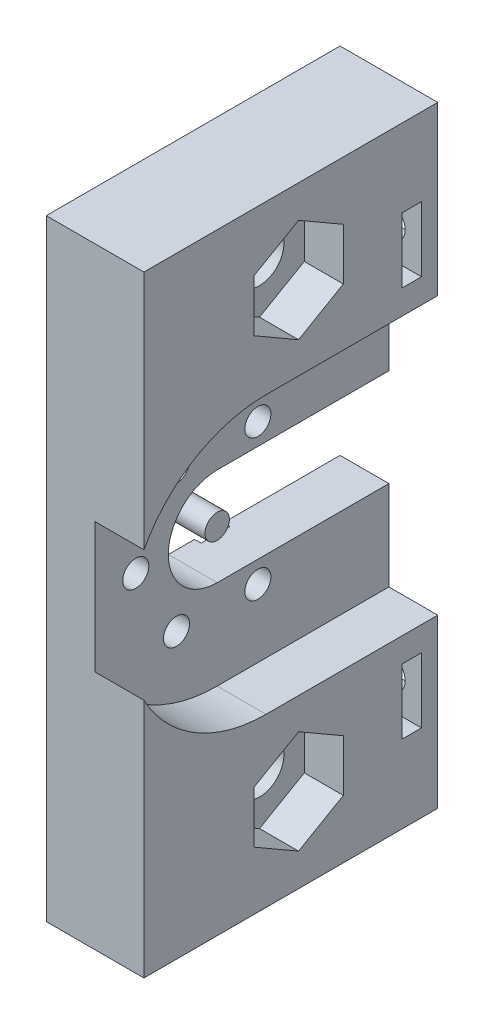
from build123d import *

# Parameters (mm, degrees)
SKETCH_2_W           = 40
SKETCH_2_H           = 15
EXTRUDE_5_DEPTH      = 3
SKETCH_10_R          = 0.8
CUT_EXTRUDE_2_DEPTH  = 23.186707732
CUT_EXTRUDE_3_DEPTH  = 23.186707732
SKETCH_12_R          = 8.5
CUT_EXTRUDE_4_DEPTH  = 3
SKETCH_13_R          = 1.6
CUT_EXTRUDE_5_DEPTH  = 0.4
SKETCH_15_R          = 0.75
EXTRUDE_6_DEPTH      = 3
SKETCH_16_R          = 1.5
CUT_EXTRUDE_6_DEPTH  = 23.186707732
SKETCH_18_R          = 2.05
CUT_EXTRUDE_8_DEPTH  = 1
CUT_EXTRUDE_10_DEPTH = 2.4
EXTRUDE_7_DEPTH      = 3.05
SKETCH_24_W          = 3
SKETCH_24_H          = 3.05
EXTRUDE_8_DEPTH      = 1.08
SKETCH_25_W          = 3
SKETCH_25_H          = 3.05
EXTRUDE_9_DEPTH      = 1
SKETCH_26_R          = 8.5
SKETCH_26_W          = 17
SKETCH_26_H          = 10.55
CUT_EXTRUDE_11_DEPTH = 3
SKETCH_28_W          = 1.220805659
SKETCH_28_H          = 18.05
CUT_EXTRUDE_12_DEPTH = 24.394497216
SKETCH_29_W          = 4
SKETCH_29_H          = 1.2
CUT_EXTRUDE_13_DEPTH = 4
SKETCH_30_R          = 1
CUT_EXTRUDE_14_DEPTH = 26.541351571


with BuildPart() as part:
    # ｽｹｯﾁ2 → ﾎﾞｽ - 押し出し5 (new, symmetric)
    with BuildSketch(Plane.YZ):
        Rectangle(SKETCH_2_W, SKETCH_2_H)
    extrude(amount=EXTRUDE_5_DEPTH, both=True)

    # ｽｹｯﾁ10 → ｶｯﾄ - 押し出し2 (cut, through all)
    with BuildSketch(Plane.YZ.offset(3)):
        with Locations(Location((-4.330127019, 2.5, 0), (0, 0, 270))):
            Circle(SKETCH_10_R)
        with Locations(Location((4.330127019, -2.5, 0), (0, 0, 270))):
            Circle(SKETCH_10_R)
        with Locations(Location((0, 5, 0), (0, 0, 270))):
            Circle(SKETCH_10_R)
        with Locations(Location((4.330127019, 2.5, 0), (0, 0, 270))):
            Circle(SKETCH_10_R)
        with Locations(Location((-4.330127019, -2.5, 0), (0, 0, 270))):
            Circle(SKETCH_10_R)
    extrude(amount=-CUT_EXTRUDE_2_DEPTH, mode=Mode.SUBTRACT)

    # ｽｹｯﾁ11 → ｶｯﾄ - 押し出し3 (cut, through all)
    with BuildSketch(Plane.YZ.offset(3)):
        with BuildLine():
            ThreePointArc((3, 0), (0, -3), (-3, 0))
            Line((-3, 0), (-3, -7.5))
            Line((-3, -7.5), (3, -7.5))
            Line((3, -7.5), (3, 0))
        make_face()
        with BuildLine():
            ThreePointArc((3, 0), (0, 3), (-3, 0))
            Line((-3, 0), (3, 0))
        make_face()
        with BuildLine():
            Line((3, 0), (-3, 0))
            ThreePointArc((-3, 0), (0, -3), (3, 0))
        make_face()
    extrude(amount=-CUT_EXTRUDE_3_DEPTH, mode=Mode.SUBTRACT)

    # ｽｹｯﾁ12 → ｶｯﾄ - 押し出し4 (cut)
    with BuildSketch(Plane.YZ.offset(3)):
        Circle(SKETCH_12_R)
    extrude(amount=-CUT_EXTRUDE_4_DEPTH, mode=Mode.SUBTRACT)

    # ｽｹｯﾁ13 → ｶｯﾄ - 押し出し5 (cut)
    with BuildSketch(Plane(origin=(-3, 0, 0), x_dir=(0, -1, 0), z_dir=(-1, 0, 0))):
        with Locations((-4.330127019, -2.5)):
            Circle(SKETCH_13_R)
        with Locations(Location((-4.330127019, 2.5, 0), (0, 0, 90))):
            Circle(SKETCH_13_R)
        with Locations(Location((0, 5, 0), (0, 0, 90))):
            Circle(SKETCH_13_R)
        with Locations(Location((4.330127019, 2.5, 0), (0, 0, 90))):
            Circle(SKETCH_13_R)
        with Locations((4.330127019, -2.5)):
            Circle(SKETCH_13_R)
    extrude(amount=-CUT_EXTRUDE_5_DEPTH, mode=Mode.SUBTRACT)

    # ｽｹｯﾁ16 → ｶｯﾄ - 押し出し6 (cut, through all)
    with BuildSketch(Plane(origin=(-3, 0, 0), x_dir=(0, -1, 0), z_dir=(-1, 0, 0))):
        with Locations(Location((-13.60376786, -2, 0), (0, 0, 90))):
            Circle(SKETCH_16_R)
        with Locations(Location((13.60376786, -2, 0), (0, 0, 90))):
            Circle(SKETCH_16_R)
    extrude(amount=-CUT_EXTRUDE_6_DEPTH, mode=Mode.SUBTRACT)

    # ｽｹｯﾁ18 → ｶｯﾄ - 押し出し8 (cut)
    with BuildSketch(Plane(origin=(-3, 0, 0), x_dir=(0, -1, 0), z_dir=(-1, 0, 0))):
        with Locations(Location((-13.60376786, -2, 0), (0, 0, 90))):
            Circle(SKETCH_18_R)
        with Locations(Location((13.60376786, -2, 0), (0, 0, 90))):
            Circle(SKETCH_18_R)
    extrude(amount=-CUT_EXTRUDE_8_DEPTH, mode=Mode.SUBTRACT)

    # ｽｹｯﾁ19 → ｶｯﾄ - 押し出し10 (cut)
    with BuildSketch(Plane.YZ.offset(3)):
        Polygon((15.191481101, -4.75), (16.779194341, -2), (15.191481101, 0.75), (12.01605462, 0.75), (10.42834138, -2), (12.01605462, -4.75), align=None)
        Polygon((-10.42834138, -2), (-12.01605462, 0.75), (-15.191481101, 0.75), (-16.779194341, -2), (-15.191481101, -4.75), (-12.01605462, -4.75), align=None)
    extrude(amount=-CUT_EXTRUDE_10_DEPTH, mode=Mode.SUBTRACT)

    # ｽｹｯﾁ23 → ﾎﾞｽ - 押し出し7 (add)
    with BuildSketch(Plane(origin=(0, 0, -7.5), x_dir=(1, 0, 0), z_dir=(0, 0, -1))):
        Polygon((-3, 4.077623582), (-3, 3), (0, 3), (0, 4.077623582), (3, 4.077623582), (3, 20), (-3, 20), align=None)
        Polygon((-3, -3), (0, -3), (0, -4), (3, -4), (3, -20), (-3, -20), (-3, -4), align=None)
    extrude(amount=EXTRUDE_7_DEPTH)

    # ｽｹｯﾁ24 → ﾎﾞｽ - 押し出し8 (add)
    with BuildSketch(Plane(origin=(0, -4.077623582, 0), x_dir=(-1, 0, 0), z_dir=(0, 1, 0))):
        with Locations((-1.5, -9.025)):
            Rectangle(SKETCH_24_W, SKETCH_24_H)
    extrude(amount=EXTRUDE_8_DEPTH)

    # ｽｹｯﾁ25 → ﾎﾞｽ - 押し出し9 (add)
    with BuildSketch(Plane.XZ.offset(-4)):
        with Locations((1.5, -9.025)):
            Rectangle(SKETCH_25_W, SKETCH_25_H)
    extrude(amount=EXTRUDE_9_DEPTH)

    # ｽｹｯﾁ26 → ｶｯﾄ - 押し出し11 (cut)
    with BuildSketch(Plane.YZ.offset(3)):
        Circle(SKETCH_26_R)
        with Locations((0, -5.275)):
            Rectangle(SKETCH_26_W, SKETCH_26_H)
    extrude(amount=-CUT_EXTRUDE_11_DEPTH, mode=Mode.SUBTRACT)

    # ｽｹｯﾁ28 → ｶｯﾄ - 押し出し12 (cut, through all)
    with BuildSketch(Plane.YZ.offset(3)):
        with Locations((-19.389597171, -1.525)):
            Rectangle(SKETCH_28_W, SKETCH_28_H)
        with Locations((19.389597171, -1.525)):
            Rectangle(SKETCH_28_W, SKETCH_28_H)
    extrude(amount=-CUT_EXTRUDE_12_DEPTH, mode=Mode.SUBTRACT)

    # ｽｹｯﾁ29 → ｶｯﾄ - 押し出し13 (cut)
    with BuildSketch(Plane.YZ.offset(3)):
        with Locations((-12, -8.95)):
            Rectangle(SKETCH_29_W, SKETCH_29_H)
        with Locations((12, -8.95)):
            Rectangle(SKETCH_29_W, SKETCH_29_H)
    extrude(amount=-CUT_EXTRUDE_13_DEPTH, mode=Mode.SUBTRACT)

    # ｽｹｯﾁ30 → ｶｯﾄ - 押し出し14 (cut, through all)
    with BuildSketch(Plane.XY.offset(-9.55)):
        with Locations((1, -12)):
            Circle(SKETCH_30_R)
        with Locations(Location((1, 12, 0), (0, 0, 180))):
            Circle(SKETCH_30_R)
    extrude(amount=-CUT_EXTRUDE_14_DEPTH, mode=Mode.SUBTRACT)


with BuildPart() as body_2:
    # ｽｹｯﾁ15 → ﾎﾞｽ - 押し出し6 (new body)
    with BuildSketch(Plane.YZ):
        with Locations(Location((0, 0, 0), (0, 0, 270))):
            Circle(SKETCH_15_R)
    extrude(amount=-EXTRUDE_6_DEPTH)


solid = Compound([part.part, body_2.part])
